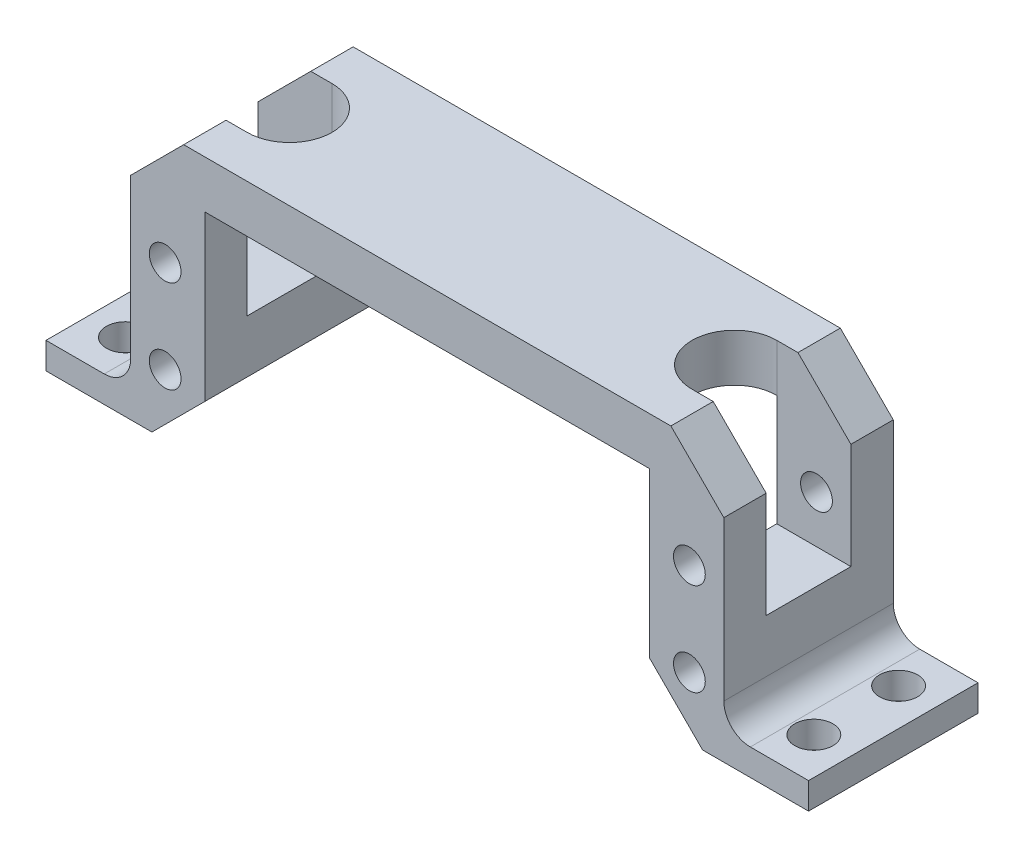
from build123d import *

# Parameters (mm, degrees)
BOSS_EXTRUDE1_DEPTH = 8
CHAMFER5_SIZE       = 5
FILLET1_R           = 2.5
SKETCH2_R           = 1.5
CUT_EXTRUDE1_DEPTH  = 47.658332589
SKETCH3_R           = 1.8
CUT_EXTRUDE2_DEPTH  = 44.200115741
SKETCH5_W           = 7
SKETCH5_H           = 8
CUT_EXTRUDE3_DEPTH  = 15
CUT_EXTRUDE5_DEPTH  = 15


with BuildPart() as part:
    # Sketch1 → Boss-Extrude1 (new, symmetric)
    with BuildSketch(Plane.XY):
        Polygon((-36, 0), (-21, 0), (-21, 20.5), (21, 20.5), (21, 0), (36, 0), (36, 2.5), (28, 2.5), (28, 25), (-28, 25), (-28, 2.5), (-36, 2.5), align=None)
    extrude(amount=BOSS_EXTRUDE1_DEPTH, both=True)

    # Chamfer5
    chamfer5_edges = [part.edges().sort_by_distance(p)[0] for p in [
        (-28, 25, 0),
        (28, 25, 0),
        (21, 0, 0),
        (-21, 0, 0),
    ]]
    chamfer(chamfer5_edges, length=CHAMFER5_SIZE)

    # Fillet1
    fillet1_edges = [part.edges().sort_by_distance(p)[0] for p in [
        (-28, 2.5, 0),
        (28, 2.5, 0),
    ]]
    fillet(fillet1_edges, radius=FILLET1_R)

    # Sketch2 → Cut-Extrude1 (cut, through all)
    with BuildSketch(Plane.XY.offset(8)):
        with Locations((-24.75, 14.475)):
            Circle(SKETCH2_R)
        with Locations((-24.75, 5.725)):
            Circle(SKETCH2_R)
        with Locations((24.75, 14.475)):
            Circle(SKETCH2_R)
        with Locations((24.75, 5.725)):
            Circle(SKETCH2_R)
    extrude(amount=-CUT_EXTRUDE1_DEPTH, mode=Mode.SUBTRACT)

    # Sketch3 → Cut-Extrude2 (cut, through all)
    with BuildSketch(Plane(origin=(0, 2.5, 0), x_dir=(1, 0, 0), z_dir=(0, 1, 0))):
        with Locations(Location((32.5, 4, 0), (0, 0, 270))):
            Circle(SKETCH3_R)
        with Locations(Location((32.5, -4, 0), (0, 0, 270))):
            Circle(SKETCH3_R)
        with Locations(Location((-32.5, 4, 0), (0, 0, 270))):
            Circle(SKETCH3_R)
        with Locations(Location((-32.5, -4, 0), (0, 0, 270))):
            Circle(SKETCH3_R)
    extrude(amount=-CUT_EXTRUDE2_DEPTH, mode=Mode.SUBTRACT)

    # Sketch5 → Cut-Extrude3 (cut)
    with BuildSketch(Plane(origin=(0, 25, 0), x_dir=(1, 0, 0), z_dir=(0, 1, 0))):
        with Locations((24.5, 0)):
            Rectangle(SKETCH5_W, SKETCH5_H)
        with Locations((-24.5, 0)):
            Rectangle(SKETCH5_W, SKETCH5_H)
    extrude(amount=-CUT_EXTRUDE3_DEPTH, mode=Mode.SUBTRACT)

    # Sketch7 → Cut-Extrude5 (cut)
    with BuildSketch(Plane(origin=(0, 25, 0), x_dir=(1, 0, 0), z_dir=(0, 1, 0))):
        with BuildLine():
            Line((21, 4), (21, -4))
            ThreePointArc((21, -4), (17, 0), (21, 4))
        make_face()
        with BuildLine():
            Line((-21, 4), (-21, -4))
            ThreePointArc((-21, -4), (-17, 0), (-21, 4))
        make_face()
    extrude(amount=-CUT_EXTRUDE5_DEPTH, mode=Mode.SUBTRACT)


solid = part.part
